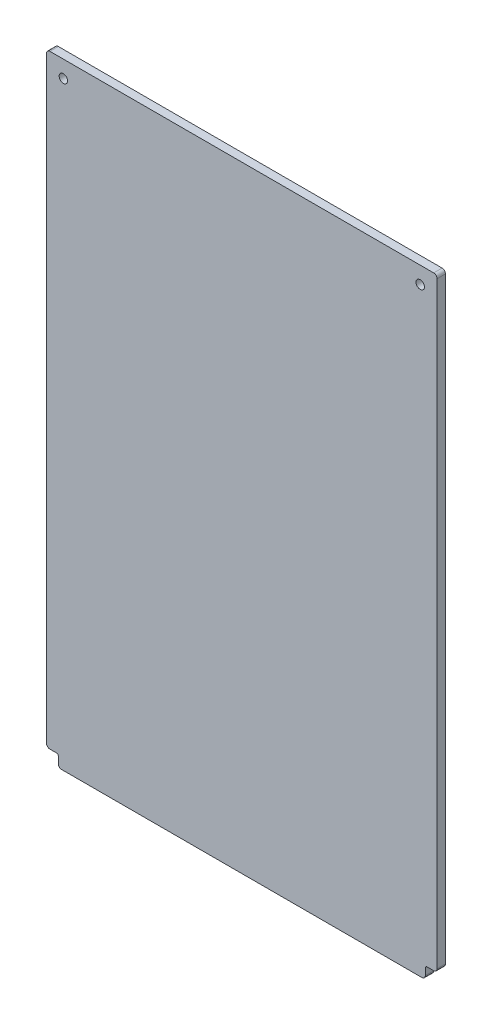
from build123d import *

# Parameters (mm, degrees)
SKETCH1_R           = 3.175
BOSS_EXTRUDE1_DEPTH = 6.35
FILLET1_R           = 1.27
FILLET2_R           = 2.54


with BuildPart() as part:
    # Sketch1 → Boss-Extrude1 (new body)
    with BuildSketch(Plane.XY):
        Polygon((0, 464.82), (294.64, 464.82), (294.64, 8.89), (285.75, 8.89), (285.75, 0), (8.89, 0), (8.89, 8.89), (0, 8.89), align=None)
        with Locations((12.7, 452.12)):
            Circle(SKETCH1_R, mode=Mode.SUBTRACT)
        with Locations((281.94, 452.12)):
            Circle(SKETCH1_R, mode=Mode.SUBTRACT)
    extrude(amount=BOSS_EXTRUDE1_DEPTH)

    # Fillet1
    fillet1_edges = [part.edges().sort_by_distance(p)[0] for p in [
        (285.75, 8.89, 3.175),
        (8.89, 8.89, 3.175),
    ]]
    fillet(fillet1_edges, radius=FILLET1_R)

    # Fillet2
    fillet2_edges = [part.edges().sort_by_distance(p)[0] for p in [
        (0, 464.82, 3.175),
        (294.64, 464.82, 3.175),
        (294.64, 8.89, 3.175),
        (285.75, 0, 3.175),
        (8.89, 0, 3.175),
        (0, 8.89, 3.175),
    ]]
    fillet(fillet2_edges, radius=FILLET2_R)


solid = part.part
